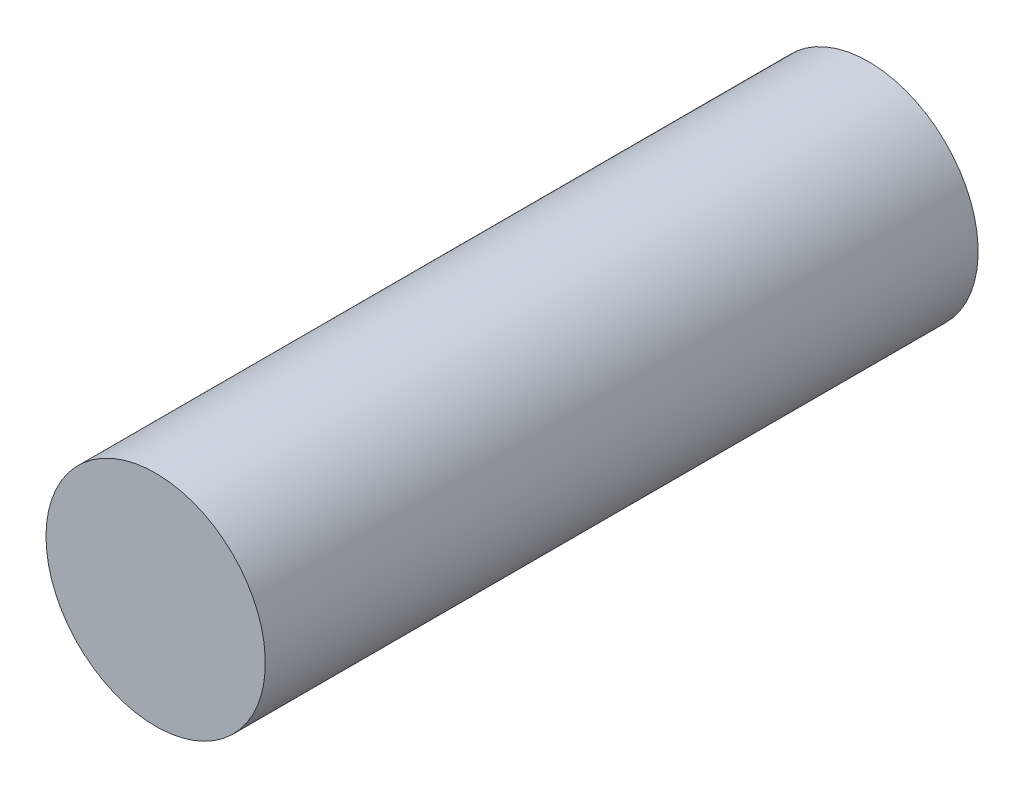
from build123d import *

# Parameters (mm, degrees)
PLANET_PIN_START = 32
SKETCH_1_R       = 4
PLANET_PIN_DEPTH = 26


with BuildPart() as part:
    # Эскиз1 → Planet_pin (new body)
    with BuildSketch(Plane.XY.offset(PLANET_PIN_START)):
        with Locations(Location((0, 0, 0), (0, 0, 180))):
            Circle(SKETCH_1_R)
    extrude(amount=PLANET_PIN_DEPTH)


solid = part.part
